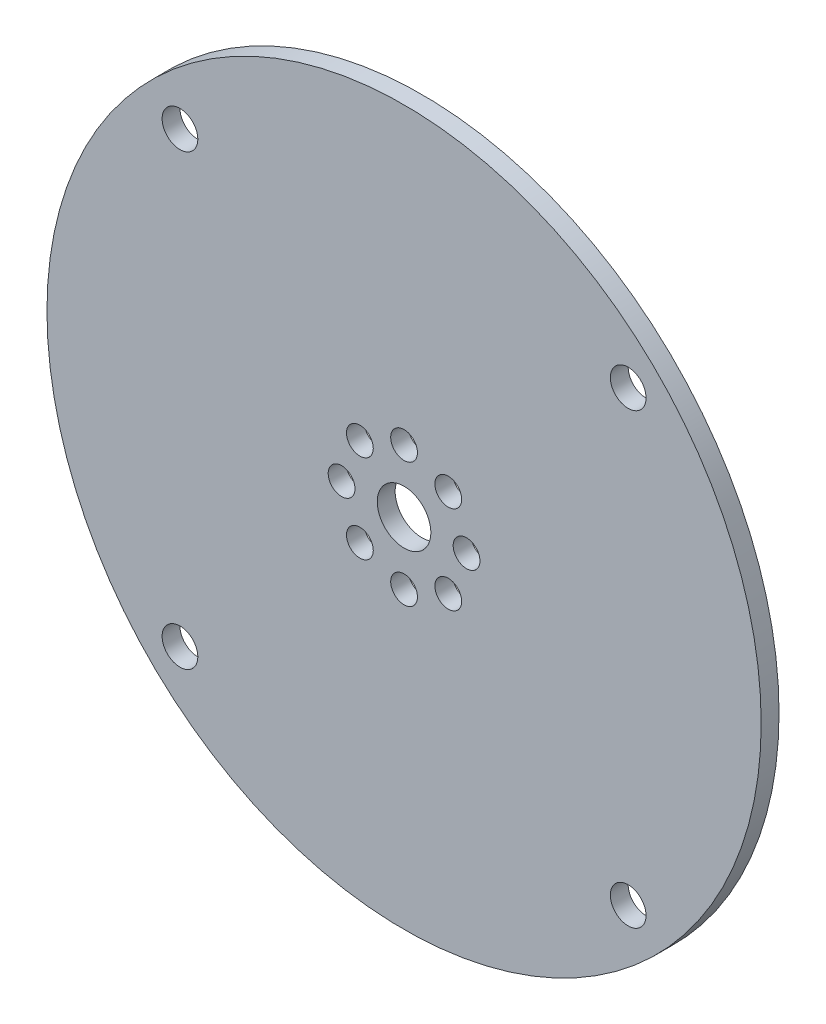
from build123d import *

# Parameters (mm, degrees)
MODEL_R         = 40
MODEL_R_2       = 1.5
MODEL_R_3       = 3
MODEL_R_4       = 2
EXTRUDE_1_DEPTH = 2


with BuildPart() as part:
    # Model → 凸台-拉伸1 (new body)
    with BuildSketch(Plane.XY):
        with Locations((2653.649726285, 1946.48951402)):
            Circle(MODEL_R)
        with Locations((2658.599473753, 1951.439261489)):
            Circle(MODEL_R_2, mode=Mode.SUBTRACT)
        with Locations((2648.699978817, 1951.439261489)):
            Circle(MODEL_R_2, mode=Mode.SUBTRACT)
        with Locations((2658.599473753, 1941.539766552)):
            Circle(MODEL_R_2, mode=Mode.SUBTRACT)
        with Locations((2648.699978817, 1941.539766552)):
            Circle(MODEL_R_2, mode=Mode.SUBTRACT)
        with Locations((2653.649726285, 1946.48951402)):
            Circle(MODEL_R_3, mode=Mode.SUBTRACT)
        with Locations((2660.649726285, 1946.48951402)):
            Circle(MODEL_R_2, mode=Mode.SUBTRACT)
        with Locations((2646.649726285, 1946.48951402)):
            Circle(MODEL_R_2, mode=Mode.SUBTRACT)
        with Locations((2678.752017017, 1921.387223288)):
            Circle(MODEL_R_4, mode=Mode.SUBTRACT)
        with Locations((2628.547435553, 1921.387223288)):
            Circle(MODEL_R_4, mode=Mode.SUBTRACT)
        with Locations((2653.649726285, 1953.48951402)):
            Circle(MODEL_R_2, mode=Mode.SUBTRACT)
        with Locations((2653.649726285, 1939.48951402)):
            Circle(MODEL_R_2, mode=Mode.SUBTRACT)
        with Locations((2628.547435553, 1971.591804753)):
            Circle(MODEL_R_4, mode=Mode.SUBTRACT)
        with Locations((2678.752017017, 1971.591804753)):
            Circle(MODEL_R_4, mode=Mode.SUBTRACT)
    extrude(amount=EXTRUDE_1_DEPTH)


solid = part.part
